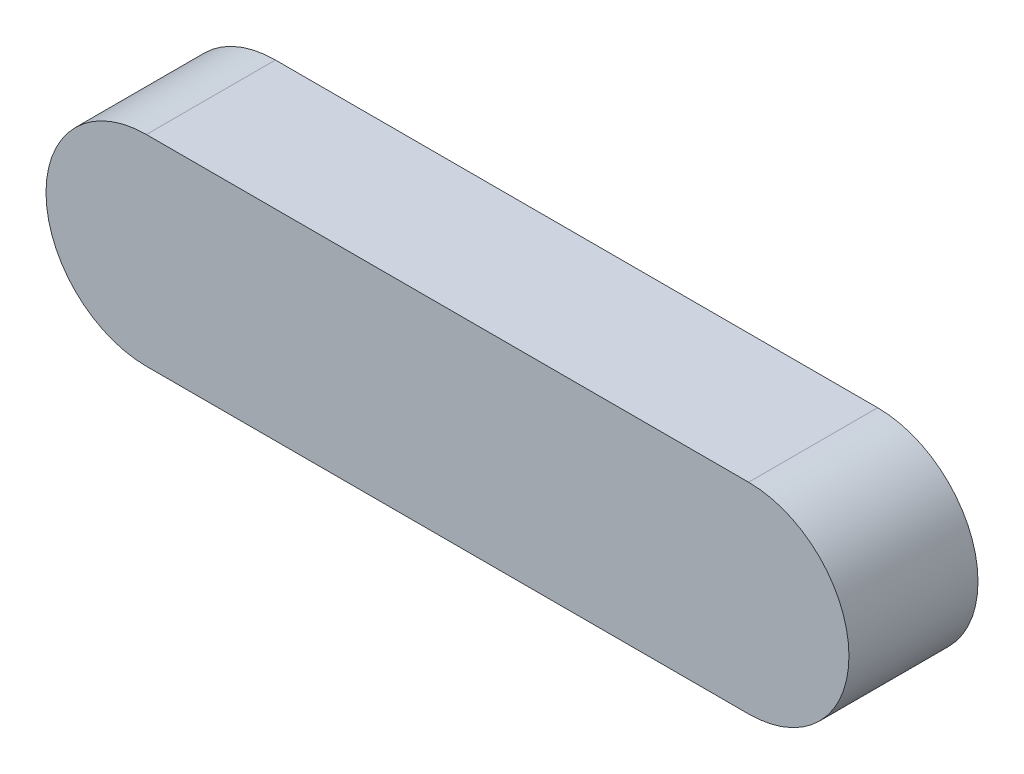
from build123d import *

# Parameters (mm, degrees)
BOSS_EXTRUDE1_DEPTH = 9


with BuildPart() as part:
    # Sketch1 → Boss-Extrude1 (new body)
    with BuildSketch(Plane.XY):
        with BuildLine():
            Line((-21, 7), (21, 7))
            ThreePointArc((21, 7), (28, 0), (21, -7))
            Line((21, -7), (-21, -7))
            ThreePointArc((-21, -7), (-28, 0), (-21, 7))
        make_face()
    extrude(amount=BOSS_EXTRUDE1_DEPTH)


solid = part.part
